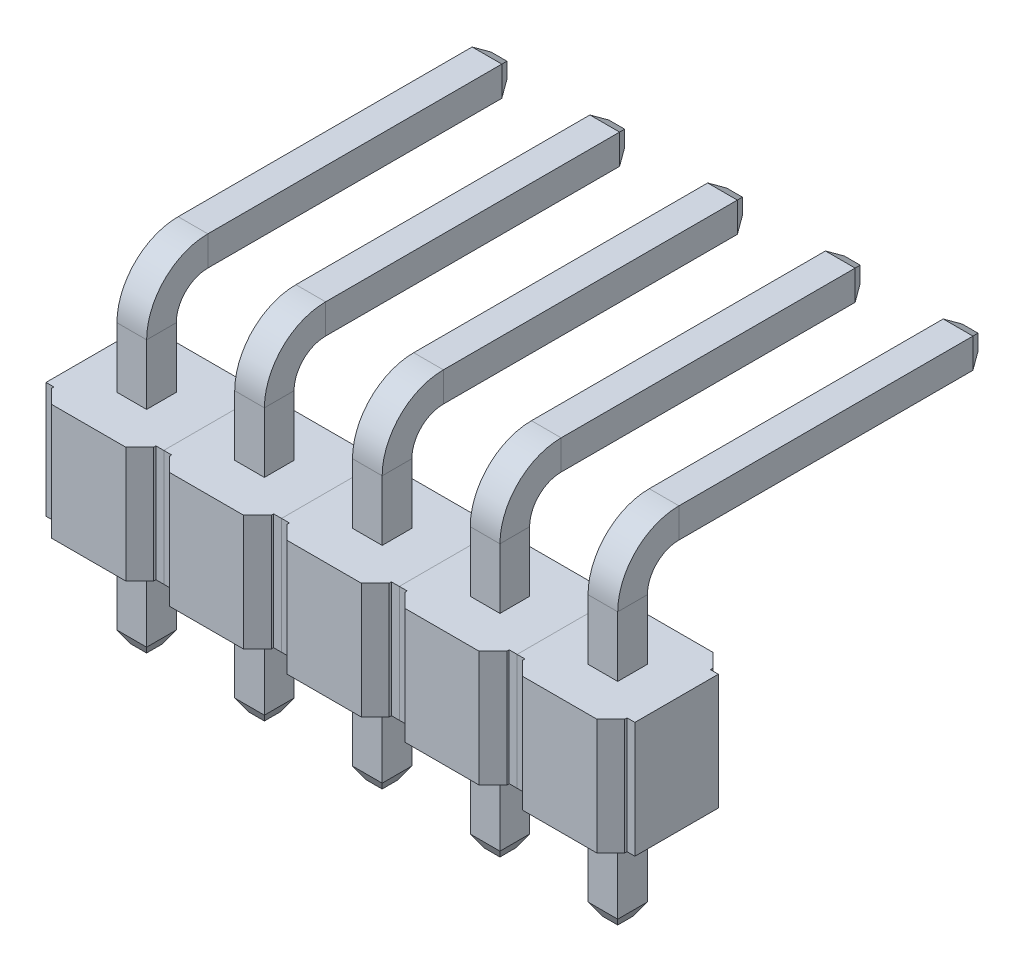
from build123d import *
from OCP.BRepFilletAPI import BRepFilletAPI_MakeChamfer

# Parameters (mm, degrees)
SKETCH_3_W             = 0.64
SKETCH_3_H             = 0.64
CHAMFER_1_SIZE         = 0.15
CHAMFER_1_SIZE2        = 0.259807621
EXTRUDE_1_DEPTH        = 2.5
CHAMFER_2_SIZE         = 0.3
PATTERN_LINEAR_1_COUNT = 5
PATTERN_LINEAR_1_PITCH = 2.54


with BuildPart() as part:
    # По траектории1: sweep along a path in Эскиз2
    with BuildLine(Plane(origin=(0, 0, 0), x_dir=(0, 0, -1), z_dir=(1, 0, 0))) as sweep_1_path:
        Line((0, -2.2), (0, 0))
        Line((0, 0), (0, 3.8))
        ThreePointArc((0, 3.8), (0.292893219, 4.507106781), (1, 4.8))
        Line((1, 4.8), (7.6, 4.8))
    # Эскиз3 → По траектории1 (sweep)
    with BuildSketch(Plane(origin=(0, 0, 0), x_dir=(1, 0, 0), z_dir=(0, 1, 0))):
        Rectangle(SKETCH_3_W, SKETCH_3_H)
    sweep(path=sweep_1_path.line)

    # Фаска1: one chamfer whose edges measure the first distance from different faces: ONE call of the kernel's chamfer builder (chamfer() names one face for all edges)
    chamfer_1_edges_1 = [part.edges().sort_by_distance(p)[0] for p in [
        (0, 4.48, -7.6),
        (-0.32, 4.8, -7.6),
        (0, 5.12, -7.6),
        (0.32, 4.8, -7.6),
    ]]
    chamfer_1_side_1 = [part.faces().sort_by_distance(p)[0] for p in [
        (0, 4.8, -7.6),
    ]]
    chamfer_1_edges_2 = [part.edges().sort_by_distance(p)[0] for p in [
        (0.32, -2.2, 0),
        (0, -2.2, -0.32),
        (-0.32, -2.2, 0),
        (0, -2.2, 0.32),
    ]]
    chamfer_1_side_2 = [part.faces().sort_by_distance(p)[0] for p in [
        (0, -2.2, 0),
    ]]
    chamfer_1 = BRepFilletAPI_MakeChamfer(part.part.solid().wrapped)
    for e in chamfer_1_edges_1:
        chamfer_1.Add(CHAMFER_1_SIZE, CHAMFER_1_SIZE2, e.wrapped, chamfer_1_side_1[0].wrapped)  # the first distance lies on this face
    for e in chamfer_1_edges_2:
        chamfer_1.Add(CHAMFER_1_SIZE, CHAMFER_1_SIZE2, e.wrapped, chamfer_1_side_2[0].wrapped)  # the first distance lies on this face
    add(Compound.cast(chamfer_1.Shape()), mode=Mode.REPLACE)


with BuildPart() as body_2:
    # Эскиз4 → Бобышка-Вытянуть1 (new body)
    with BuildSketch(Plane(origin=(0, 0, 0), x_dir=(1, 0, 0), z_dir=(0, 1, 0))):
        Polygon((-1.1, 0.9), (-1.1, 1.25), (1.1, 1.25), (1.1, 0.9), (1.27, 0.9), (1.27, -0.9), (1.1, -0.9), (1.1, -1.25), (-1.1, -1.25), (-1.1, -0.9), (-1.27, -0.9), (-1.27, 0.9), align=None)
    extrude(amount=EXTRUDE_1_DEPTH)

    # Фаска2
    chamfer_2_edges = [body_2.edges().sort_by_distance(p)[0] for p in [
        (1.1, 1.25, 1.25),
        (-1.1, 1.25, 1.25),
        (-1.1, 1.25, -1.25),
        (1.1, 1.25, -1.25),
    ]]
    chamfer(chamfer_2_edges, length=CHAMFER_2_SIZE)


with BuildPart() as pattern_linear_1_1:
    # Линейный массив1: pattern copy
    add(body_2.part.moved(Location(Vector(-1, 0, 0) * (1 * PATTERN_LINEAR_1_PITCH))))


with BuildPart() as pattern_linear_1_2:
    # Линейный массив1: pattern copy
    add(body_2.part.moved(Location(Vector(-1, 0, 0) * (2 * PATTERN_LINEAR_1_PITCH))))


with BuildPart() as pattern_linear_1_3:
    # Линейный массив1: pattern copy
    add(body_2.part.moved(Location(Vector(-1, 0, 0) * (3 * PATTERN_LINEAR_1_PITCH))))


with BuildPart() as pattern_linear_1_4:
    # Линейный массив1: pattern copy
    add(body_2.part.moved(Location(Vector(-1, 0, 0) * (4 * PATTERN_LINEAR_1_PITCH))))


with BuildPart() as pattern_linear_1_5:
    # Линейный массив1: pattern copy
    add(part.part.moved(Location(Vector(-1, 0, 0) * (1 * PATTERN_LINEAR_1_PITCH))))


with BuildPart() as pattern_linear_1_6:
    # Линейный массив1: pattern copy
    add(part.part.moved(Location(Vector(-1, 0, 0) * (2 * PATTERN_LINEAR_1_PITCH))))


with BuildPart() as pattern_linear_1_7:
    # Линейный массив1: pattern copy
    add(part.part.moved(Location(Vector(-1, 0, 0) * (3 * PATTERN_LINEAR_1_PITCH))))


with BuildPart() as pattern_linear_1_8:
    # Линейный массив1: pattern copy
    add(part.part.moved(Location(Vector(-1, 0, 0) * (4 * PATTERN_LINEAR_1_PITCH))))


solid = Compound([part.part, body_2.part, pattern_linear_1_1.part, pattern_linear_1_2.part, pattern_linear_1_3.part, pattern_linear_1_4.part, pattern_linear_1_5.part, pattern_linear_1_6.part, pattern_linear_1_7.part, pattern_linear_1_8.part])
